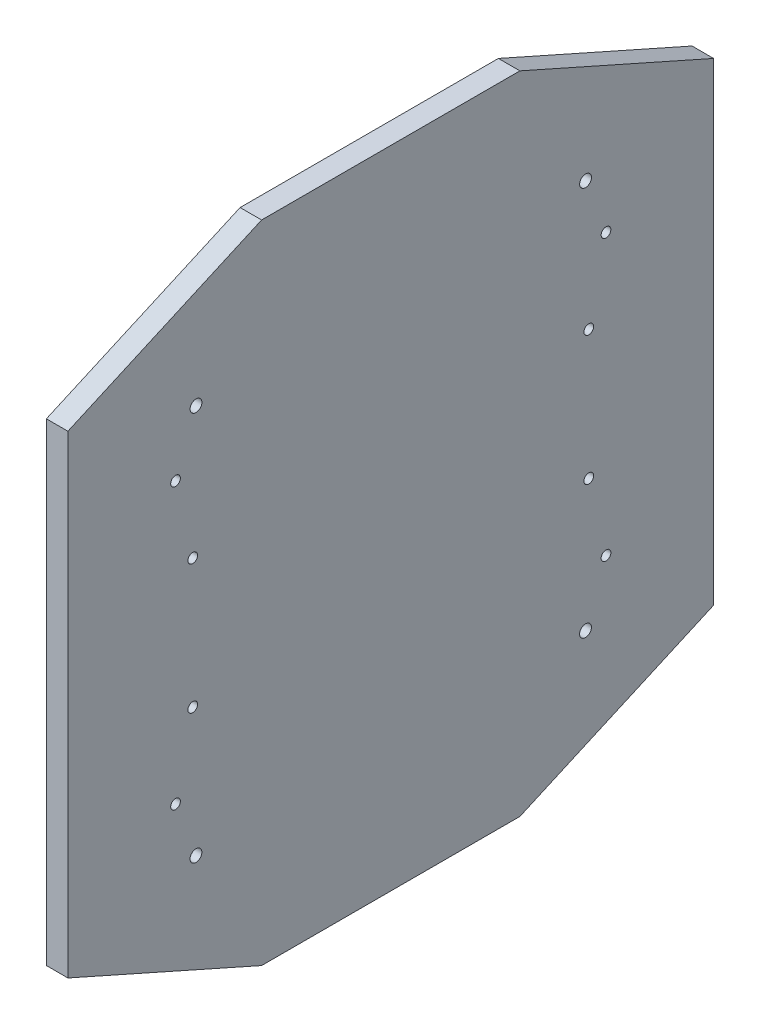
from build123d import *

# Parameters (mm, degrees)
EXTRUDE_1_DEPTH     = 10
SKETCH_2_R          = 2.25
CUT_EXTRUDE_1_DEPTH = 10
SKETCH_3_R          = 2.75
CUT_EXTRUDE_2_DEPTH = 10


with BuildPart() as part:
    # 草图1 → 凸台-拉伸1 (new body)
    with BuildSketch(Plane(origin=(0, 0, 0), x_dir=(0, 0, -1), z_dir=(1, 0, 0))):
        Polygon((-150, -110), (-150, 110), (-60, 150), (60, 150), (150, 110), (150, -110), (60, -150), (-60, -150), align=None)
    extrude(amount=EXTRUDE_1_DEPTH)

    # 草图2 → 切除-拉伸1 (cut)
    with BuildSketch(Plane(origin=(10, 0, 0), x_dir=(0, 0, -1), z_dir=(1, 0, 0))):
        with Locations((92, 30)):
            Circle(SKETCH_2_R)
        with Locations((92, -30)):
            Circle(SKETCH_2_R)
        with Locations((100, 65)):
            Circle(SKETCH_2_R)
        with Locations((100, -65)):
            Circle(SKETCH_2_R)
        with Locations(Location((-100, -65, 0), (0, 0, 180))):
            Circle(SKETCH_2_R)
        with Locations(Location((-100, 65, 0), (0, 0, 180))):
            Circle(SKETCH_2_R)
        with Locations(Location((-92, -30, 0), (0, 0, 180))):
            Circle(SKETCH_2_R)
        with Locations(Location((-92, 30, 0), (0, 0, 180))):
            Circle(SKETCH_2_R)
    extrude(amount=-CUT_EXTRUDE_1_DEPTH, mode=Mode.SUBTRACT)

    # 草图3 → 切除-拉伸2 (cut)
    with BuildSketch(Plane(origin=(10, 0, 0), x_dir=(0, 0, -1), z_dir=(1, 0, 0))):
        with Locations((-90.5, 90.5)):
            Circle(SKETCH_3_R)
        with Locations((90.5, 90.5)):
            Circle(SKETCH_3_R)
        with Locations((-90.5, -90.5)):
            Circle(SKETCH_3_R)
        with Locations((90.5, -90.5)):
            Circle(SKETCH_3_R)
    extrude(amount=-CUT_EXTRUDE_2_DEPTH, mode=Mode.SUBTRACT)


solid = part.part
